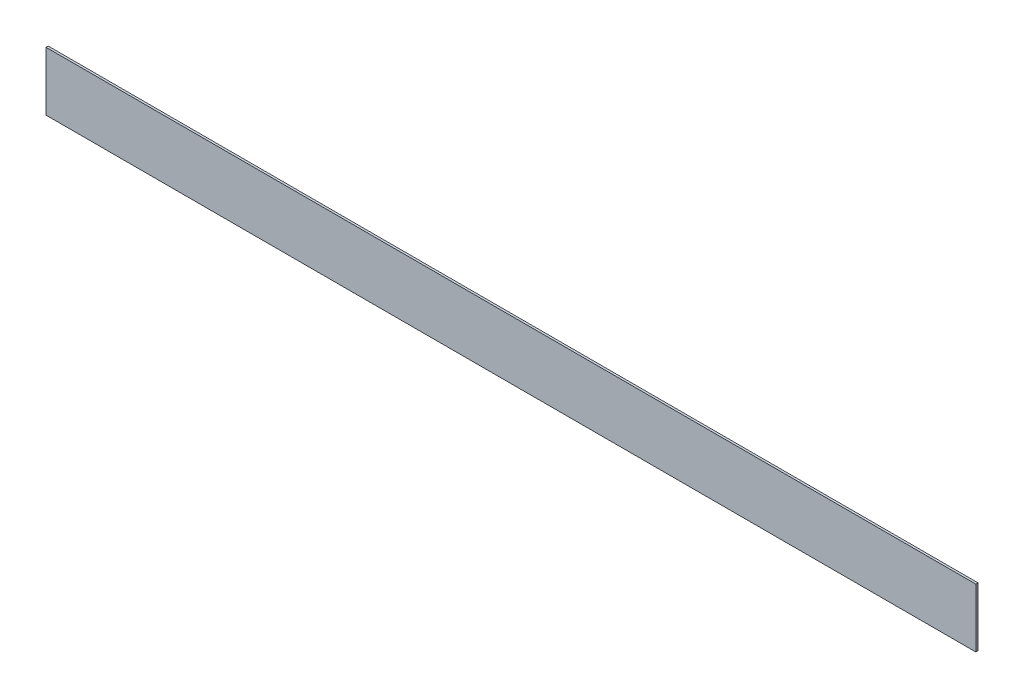
from build123d import *

# Parameters (mm, degrees)
SKETCH1_W           = 427
SKETCH1_H           = 27
BOSS_EXTRUDE1_DEPTH = 1


with BuildPart() as part:
    # Sketch1 → Boss-Extrude1 (new body)
    with BuildSketch(Plane.XY):
        Rectangle(SKETCH1_W, SKETCH1_H)
    extrude(amount=BOSS_EXTRUDE1_DEPTH)


solid = part.part
